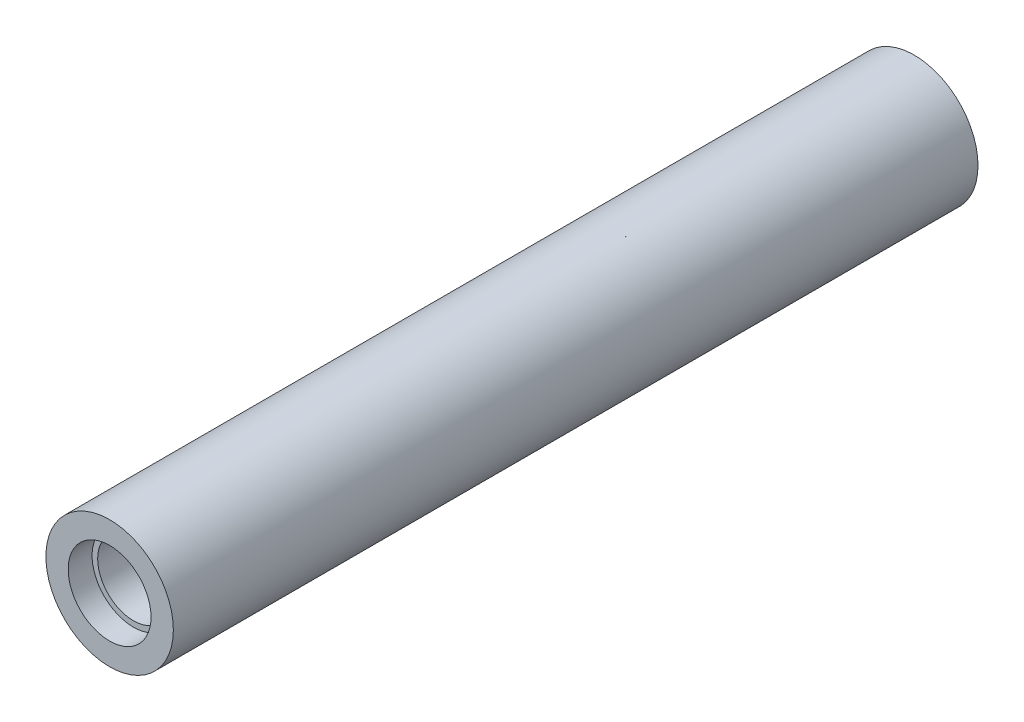
from build123d import *

# Parameters (mm, degrees)
SCHIZZO1_R               = 40
SCHIZZO1_R_2             = 22.5
ESTRUSIONE1_DEPTH        = 252.5
TAGLIO_ESTRUSIONE1_START = -15
SCHIZZO2_R               = 26
SCHIZZO2_R_2             = 22.5
TAGLIO_ESTRUSIONE1_DEPTH = 15
SCHIZZO3_R               = 26
SCHIZZO3_R_2             = 22.5
TAGLIO_ESTRUSIONE2_DEPTH = 15


with BuildPart() as part:
    # Schizzo1 → Estrusione1 (new, symmetric)
    with BuildSketch(Plane.XY):
        Circle(SCHIZZO1_R)
        Circle(SCHIZZO1_R_2, mode=Mode.SUBTRACT)
    extrude(amount=ESTRUSIONE1_DEPTH, both=True)

    # Schizzo2 → Taglio-Estrusione1 (cut)
    with BuildSketch(Plane.XY.offset(252.5).offset(TAGLIO_ESTRUSIONE1_START)):
        Circle(SCHIZZO2_R)
        Circle(SCHIZZO2_R_2, mode=Mode.SUBTRACT)
    extrude(amount=TAGLIO_ESTRUSIONE1_DEPTH, mode=Mode.SUBTRACT)

    # Schizzo3 → Taglio-Estrusione2 (cut)
    with BuildSketch(Plane(origin=(0, 0, -252.5), x_dir=(-1, 0, 0), z_dir=(0, 0, -1))):
        with Locations(Location((0, 0, 0), (0, 0, 180))):
            Circle(SCHIZZO3_R)
        Circle(SCHIZZO3_R_2, mode=Mode.SUBTRACT)
    extrude(amount=-TAGLIO_ESTRUSIONE2_DEPTH, mode=Mode.SUBTRACT)


solid = part.part
